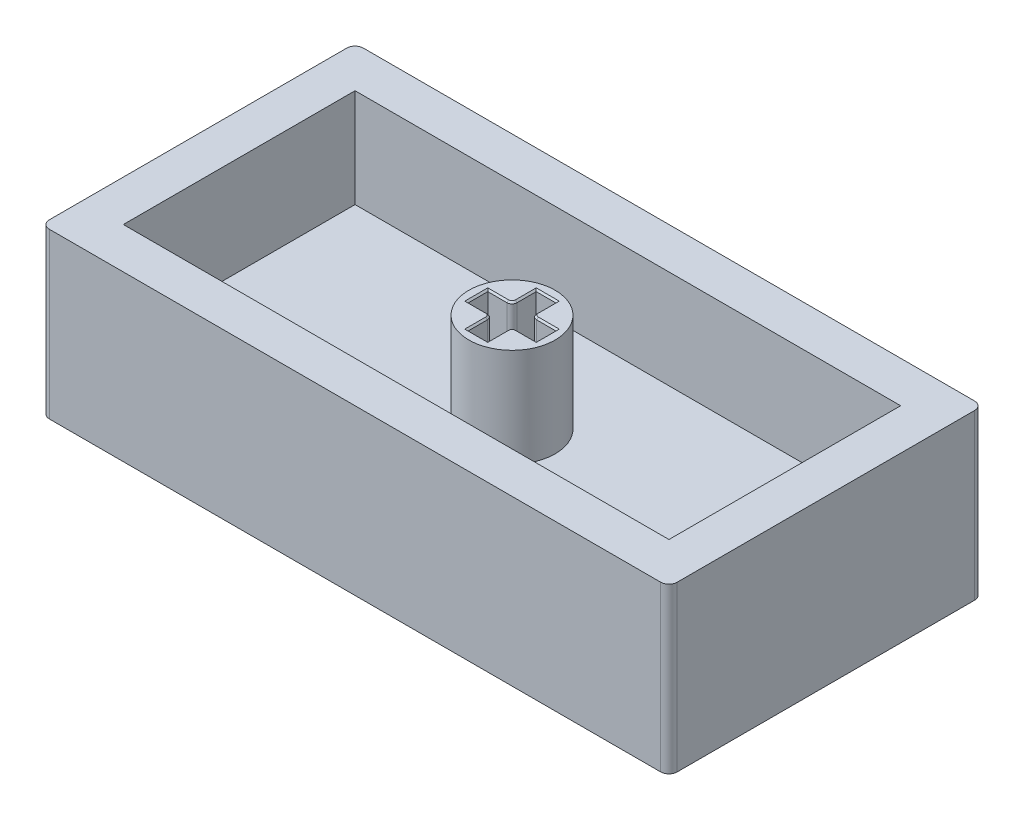
from build123d import *

# Parameters (mm, degrees)
SKETCH1_W           = 38.2
SKETCH1_H           = 19.1
SKETCH1_W_2         = 33.2
SKETCH1_H_2         = 14.1
BOSS_EXTRUDE1_DEPTH = 10
SKETCH1_2_W         = 33.2
SKETCH1_2_H         = 14.1
BOSS_EXTRUDE2_DEPTH = 4
SKETCH2_R           = 2.625
BOSS_EXTRUDE3_DEPTH = 6
CHAMFER1_SIZE       = 0.1
FILLET1_R           = 0.5


with BuildPart() as part:
    # Sketch1 → Boss-Extrude1 (new body)
    with BuildSketch(Plane(origin=(0, 0, 0), x_dir=(1, 0, 0), z_dir=(0, 1, 0))):
        Rectangle(SKETCH1_W, SKETCH1_H)
        Rectangle(SKETCH1_W_2, SKETCH1_H_2, mode=Mode.SUBTRACT)
    extrude(amount=BOSS_EXTRUDE1_DEPTH)

    # Sketch1<2> → Boss-Extrude2 (add)
    with BuildSketch(Plane(origin=(0, 0, 0), x_dir=(1, 0, 0), z_dir=(0, 1, 0))):
        Rectangle(SKETCH1_2_W, SKETCH1_2_H)
    extrude(amount=BOSS_EXTRUDE2_DEPTH)

    # Sketch2 → Boss-Extrude3 (add)
    with BuildSketch(Plane(origin=(0, 4, 0), x_dir=(1, 0, 0), z_dir=(0, 1, 0))):
        with Locations(Location((0, 0, 0), (0, 0, 90))):
            Circle(SKETCH2_R)
        with BuildLine():
            Line((-0.9, -0.6), (-2.075, -0.6))
            Line((-2.075, -0.6), (-2.075, 0.6))
            Line((-2.075, 0.6), (-0.9, 0.6))
            ThreePointArc((-0.9, 0.6), (-0.687867966, 0.687867966), (-0.6, 0.9))
            Line((-0.6, 0.9), (-0.6, 2.075))
            Line((-0.6, 2.075), (0.6, 2.075))
            Line((0.6, 2.075), (0.6, 0.9))
            ThreePointArc((0.6, 0.9), (0.687867966, 0.687867966), (0.9, 0.6))
            Line((0.9, 0.6), (2.075, 0.6))
            Line((2.075, 0.6), (2.075, -0.6))
            Line((2.075, -0.6), (0.9, -0.6))
            ThreePointArc((0.9, -0.6), (0.687867966, -0.687867966), (0.6, -0.9))
            Line((0.6, -0.9), (0.6, -2.075))
            Line((0.6, -2.075), (-0.6, -2.075))
            Line((-0.6, -2.075), (-0.6, -0.9))
            ThreePointArc((-0.6, -0.9), (-0.687867966, -0.687867966), (-0.9, -0.6))
        make_face(mode=Mode.SUBTRACT)
    extrude(amount=BOSS_EXTRUDE3_DEPTH)

    # Chamfer1
    chamfer1_edges = [part.edges().sort_by_distance(p)[0] for p in [
        (-0.6, 10, 1.4875),
        (-0.687867966, 10, 0.687867966),
        (-2.075, 10, 0),
        (-1.4875, 10, -0.6),
        (-0.687867966, 10, -0.687867966),
        (-0.6, 10, -1.4875),
        (0, 10, -2.075),
        (0.687867966, 10, -0.687867966),
        (1.4875, 10, -0.6),
        (0.687867966, 10, 0.687867966),
        (-1.4875, 10, 0.6),
        (0.6, 10, -1.4875),
        (2.075, 10, 0),
        (1.4875, 10, 0.6),
        (0.6, 10, 1.4875),
        (0, 10, 2.075),
    ]]
    chamfer(chamfer1_edges, length=CHAMFER1_SIZE)

    # Fillet1
    fillet1_edges = [part.edges().sort_by_distance(p)[0] for p in [
        (19.1, 5, 9.55),
        (-19.1, 5, 9.55),
        (-19.1, 5, -9.55),
        (19.1, 5, -9.55),
    ]]
    fillet(fillet1_edges, radius=FILLET1_R)


solid = part.part
